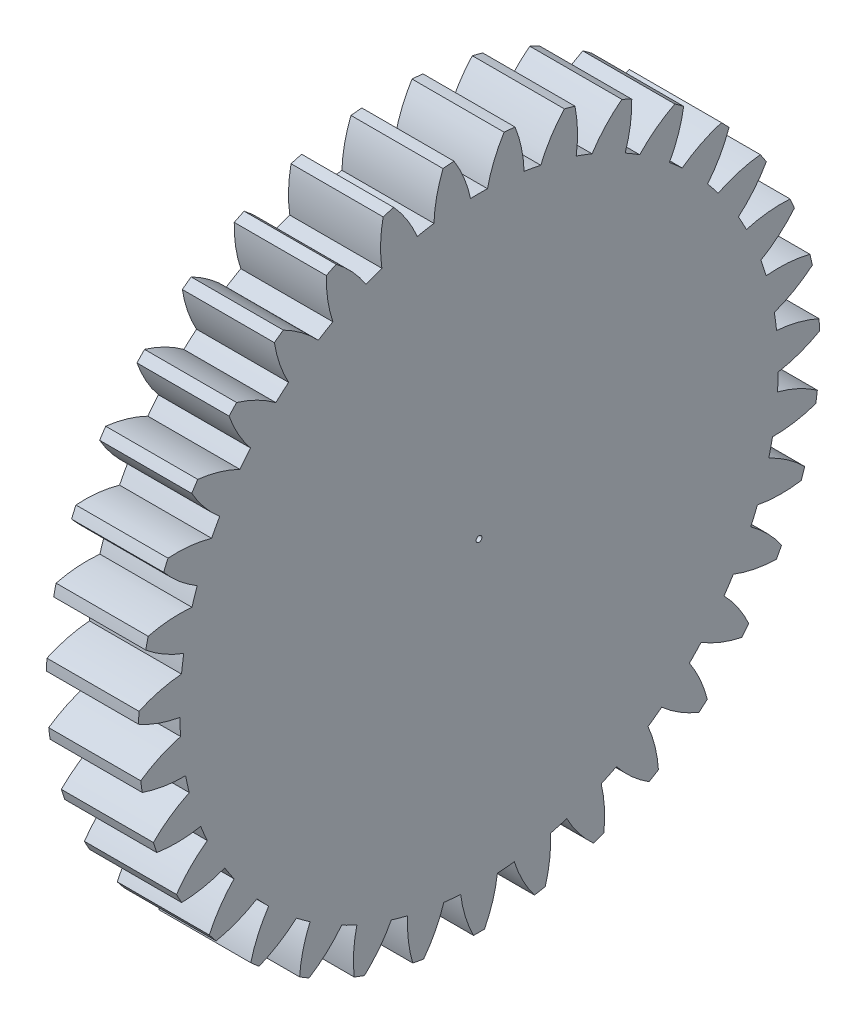
from build123d import *

# Parameters (mm, degrees)
BASPROSKE_W     = 12.7
BASPROSKE_H     = 46.99
TOOTHCUT_DEPTH  = 68.656560657
TEETHCUTS_COUNT = 35
TEETHCUTS_ANGLE = 349.714285714
BORSKE_R        = 0.396875
BORE_DEPTH      = 50.8000508


with BuildPart() as part:
    # BasProSke → Base-Revolve (revolve)
    with BuildSketch(Plane(origin=(0, 0, 0), x_dir=(1, 0, 0), z_dir=(0, 1, 0)), mode=Mode.PRIVATE) as base_revolve_sk:
        with Locations((6.35, 23.495)):
            Rectangle(BASPROSKE_W, BASPROSKE_H)
    revolve(base_revolve_sk.sketch.rotate(Axis((-10, 0, 0), (1, 0, 0)), 180), axis=Axis((-10, 0, 0), (1, 0, 0)))

    # TooCutSke → ToothCut (cut, through all)
    with BuildSketch(Plane(origin=(0, 0, 0), x_dir=(0, 0, -1), z_dir=(1, 0, 0))):
        with BuildLine():
            ThreePointArc((1.167693396, 41.257208828), (0, 41.27373), (-1.167693396, 41.257208828))
            ThreePointArc((-1.167693396, 41.257208828), (-2.077852758, 44.171408899), (-3.473147062, 46.886939404))
            ThreePointArc((-3.473147062, 46.886939404), (0, 47.0154), (3.473147062, 46.886939404))
            ThreePointArc((3.473147062, 46.886939404), (2.077852758, 44.171408899), (1.167693396, 41.257208828))
        make_face()
    toothcut = extrude(amount=TOOTHCUT_DEPTH, mode=Mode.SUBTRACT)

    # TeethCuts: ToothCut ×35 about axis
    teethcuts_axis = Axis((-10, 0, 0), (1, 0, 0))
    for i in range(1, TEETHCUTS_COUNT):
        add(toothcut.rotate(teethcuts_axis, i * TEETHCUTS_ANGLE / (TEETHCUTS_COUNT - 1)), mode=Mode.SUBTRACT)

    # BorSke → Bore (cut, symmetric)
    with BuildSketch(Plane(origin=(0, 0, 0), x_dir=(0, 0, -1), z_dir=(1, 0, 0))):
        with Locations(Location((0, 0, 0), (0, 0, 180))):
            Circle(BORSKE_R)
    extrude(amount=BORE_DEPTH, both=True, mode=Mode.SUBTRACT)


solid = part.part
